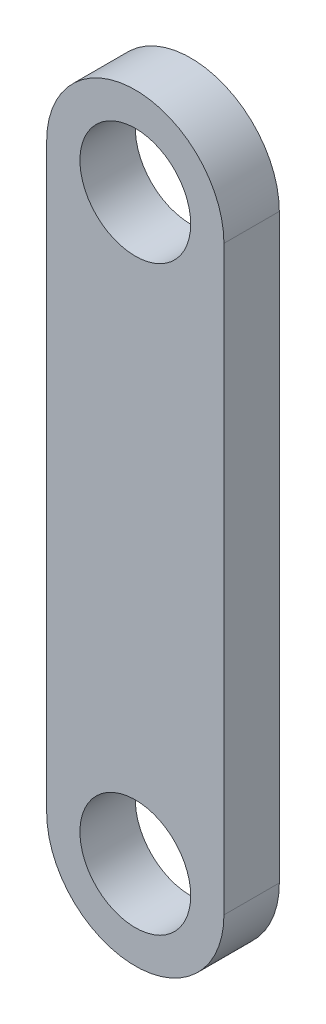
from build123d import *

# Parameters (mm, degrees)
SKETCH_1_R      = 0.5
EXTRUDE_1_DEPTH = 0.5


with BuildPart() as part:
    # 草圖1 → 填料-伸長1 (new body)
    with BuildSketch(Plane.XY):
        with BuildLine():
            Line((-0.8, -2.625), (-0.8, 2.625))
            ThreePointArc((-0.8, 2.625), (0, 3.425), (0.8, 2.625))
            Line((0.8, 2.625), (0.8, -2.625))
            ThreePointArc((0.8, -2.625), (0, -3.425), (-0.8, -2.625))
        make_face()
        with Locations((0, 2.625)):
            Circle(SKETCH_1_R, mode=Mode.SUBTRACT)
        with Locations((0, -2.625)):
            Circle(SKETCH_1_R, mode=Mode.SUBTRACT)
    extrude(amount=EXTRUDE_1_DEPTH)


solid = part.part
